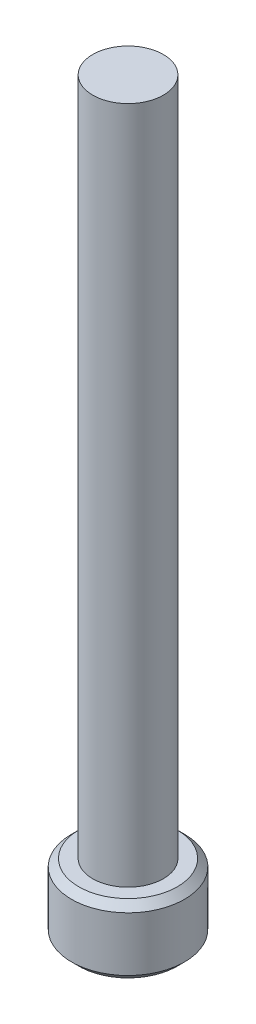
from build123d import *

# Parameters (mm, degrees)
SKETCH1_R           = 2.4765
BOSS_EXTRUDE1_DEPTH = 47.625
SKETCH2_R           = 3.9624
BOSS_EXTRUDE2_DEPTH = 4.826
CUT_EXTRUDE1_DEPTH  = 2.286
CHAMFER1_SIZE       = 0.508


with BuildPart() as part:
    # Sketch1 → Boss-Extrude1 (new body)
    with BuildSketch(Plane(origin=(0, 0, 0), x_dir=(1, 0, 0), z_dir=(0, 1, 0))):
        with Locations(Location((0, 0, 0), (0, 0, 270))):
            Circle(SKETCH1_R)
    extrude(amount=BOSS_EXTRUDE1_DEPTH)

    # Sketch2 → Boss-Extrude2 (add)
    with BuildSketch(Plane.XZ):
        with Locations(Location((0, 0, 0), (0, 0, 270))):
            Circle(SKETCH2_R)
    extrude(amount=BOSS_EXTRUDE2_DEPTH)

    # Sketch3 → Cut-Extrude1 (cut)
    with BuildSketch(Plane.XZ.offset(4.826)):
        Polygon((2.291358881, 0), (1.14567944, 1.984375), (-1.14567944, 1.984375), (-2.291358881, 0), (-1.14567944, -1.984375), (1.14567944, -1.984375), align=None)
    extrude(amount=-CUT_EXTRUDE1_DEPTH, mode=Mode.SUBTRACT)

    # Chamfer1
    chamfer1_edges = [part.edges().sort_by_distance(p)[0] for p in [
        (0, 0, 3.9624),
        (0, -4.826, 3.9624),
    ]]
    chamfer(chamfer1_edges, length=CHAMFER1_SIZE)


solid = part.part
